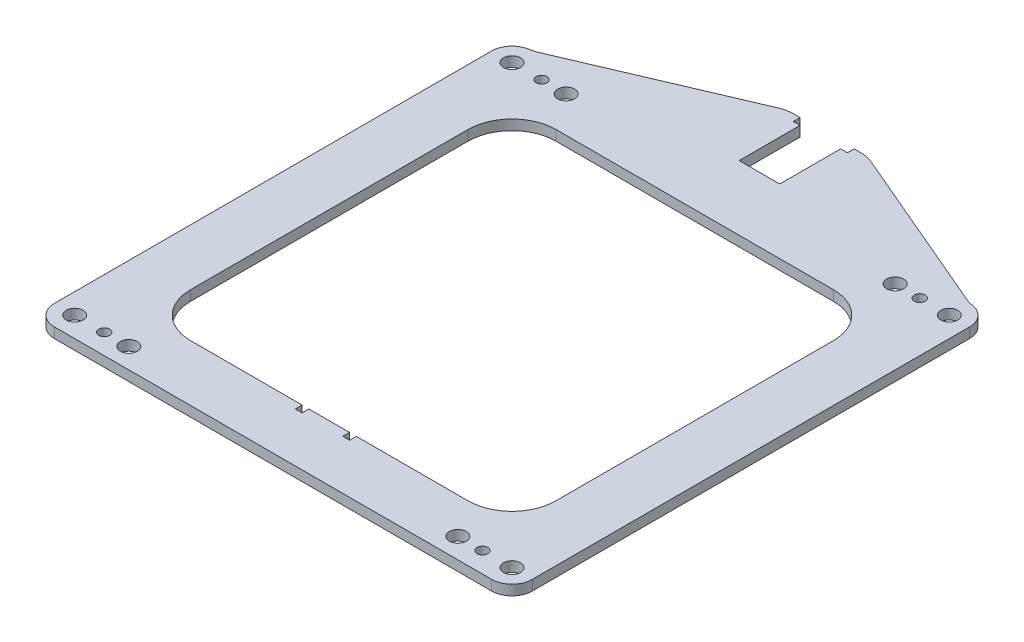
from build123d import *

# Parameters (mm, degrees)
SKETCH1_R           = 2.5
SKETCH1_R_2         = 1.6
BOSS_EXTRUDE1_DEPTH = 3
SKETCH2_W           = 2
SKETCH2_H           = 2
CUT_EXTRUDE1_DEPTH  = 117.880152293


with BuildPart() as part:
    # Sketch1 → Boss-Extrude1 (new body)
    with BuildSketch(Plane(origin=(0, 0, 0), x_dir=(1, 0, 0), z_dir=(0, 1, 0))):
        with BuildLine():
            Line((-64.6, -70.6), (64.6, -70.6))
            ThreePointArc((64.6, -70.6), (68.842640687, -68.842640687), (70.6, -64.6))
            Line((70.6, -64.6), (70.6, 64.6))
            ThreePointArc((70.6, 64.6), (69.163190657, 68.495804286), (65.540902989, 70.525765905))
            ThreePointArc((65.540902989, 70.525765905), (64.340790015, 70.792848887), (63.182522555, 71.205184867))
            Line((63.182522555, 71.205184867), (13.781138102, 92.296857547))
            ThreePointArc((13.781138102, 92.296857547), (11.858510235, 92.897157125), (9.854586018, 93.1))
            Line((9.854586018, 93.1), (6, 93.1))
            Line((6, 93.1), (6, 73.1))
            Line((6, 73.1), (-6, 73.1))
            Line((-6, 73.1), (-6, 93.1))
            Line((-6, 93.1), (-9.854586018, 93.1))
            ThreePointArc((-9.854586018, 93.1), (-11.858510235, 92.897157125), (-13.781138102, 92.296857547))
            Line((-13.781138102, 92.296857547), (-63.182522555, 71.205184867))
            ThreePointArc((-63.182522555, 71.205184867), (-64.340790015, 70.792848887), (-65.540902989, 70.525765905))
            ThreePointArc((-65.540902989, 70.525765905), (-69.163190657, 68.495804286), (-70.6, 64.6))
            Line((-70.6, 64.6), (-70.6, -64.6))
            ThreePointArc((-70.6, -64.6), (-68.842640687, -68.842640687), (-64.6, -70.6))
        make_face()
        with Locations(Location((64.6, -64.6, 0), (0, 0, 270))):
            Circle(SKETCH1_R, mode=Mode.SUBTRACT)
        with Locations(Location((48.6, -64.6, 0), (0, 0, 270))):
            Circle(SKETCH1_R, mode=Mode.SUBTRACT)
        with Locations(Location((-55.87, 64.6, 0), (0, 0, 270))):
            Circle(SKETCH1_R_2, mode=Mode.SUBTRACT)
        with Locations(Location((55.87, -64.6, 0), (0, 0, 270))):
            Circle(SKETCH1_R_2, mode=Mode.SUBTRACT)
        with Locations(Location((-48.6, 64.6, 0), (0, 0, 270))):
            Circle(SKETCH1_R, mode=Mode.SUBTRACT)
        with Locations(Location((55.87, 64.6, 0), (0, 0, 270))):
            Circle(SKETCH1_R_2, mode=Mode.SUBTRACT)
        with Locations(Location((48.6, 64.6, 0), (0, 0, 270))):
            Circle(SKETCH1_R, mode=Mode.SUBTRACT)
        with Locations(Location((64.6, 64.6, 0), (0, 0, 270))):
            Circle(SKETCH1_R, mode=Mode.SUBTRACT)
        with Locations(Location((-55.87, -64.6, 0), (0, 0, 270))):
            Circle(SKETCH1_R_2, mode=Mode.SUBTRACT)
        with Locations(Location((-48.6, -64.6, 0), (0, 0, 270))):
            Circle(SKETCH1_R, mode=Mode.SUBTRACT)
        with Locations(Location((-64.6, -64.6, 0), (0, 0, 270))):
            Circle(SKETCH1_R, mode=Mode.SUBTRACT)
        with Locations(Location((-64.6, 64.6, 0), (0, 0, 270))):
            Circle(SKETCH1_R, mode=Mode.SUBTRACT)
        with BuildLine():
            ThreePointArc((-41, 54), (-50.192388155, 50.192388155), (-54, 41))
            Line((-54, 41), (-54, -41))
            ThreePointArc((-54, -41), (-50.192388155, -50.192388155), (-41, -54))
            Line((-41, -54), (41, -54))
            ThreePointArc((41, -54), (50.192388155, -50.192388155), (54, -41))
            Line((54, -41), (54, 41))
            ThreePointArc((54, 41), (50.192388155, 50.192388155), (41, 54))
            Line((41, 54), (-41, 54))
        make_face(mode=Mode.SUBTRACT)
    extrude(amount=BOSS_EXTRUDE1_DEPTH)

    # Sketch2 → Cut-Extrude1 (cut, through all)
    with BuildSketch(Plane(origin=(0, 3, 0), x_dir=(1, 0, 0), z_dir=(0, 1, 0))):
        with Locations((-7, 92.1)):
            Rectangle(SKETCH2_W, SKETCH2_H)
        with Locations((7, 92.1)):
            Rectangle(SKETCH2_W, SKETCH2_H)
        with Locations((-7, -55)):
            Rectangle(SKETCH2_W, SKETCH2_H)
        with Locations((7, -55)):
            Rectangle(SKETCH2_W, SKETCH2_H)
    extrude(amount=-CUT_EXTRUDE1_DEPTH, mode=Mode.SUBTRACT)


solid = part.part
